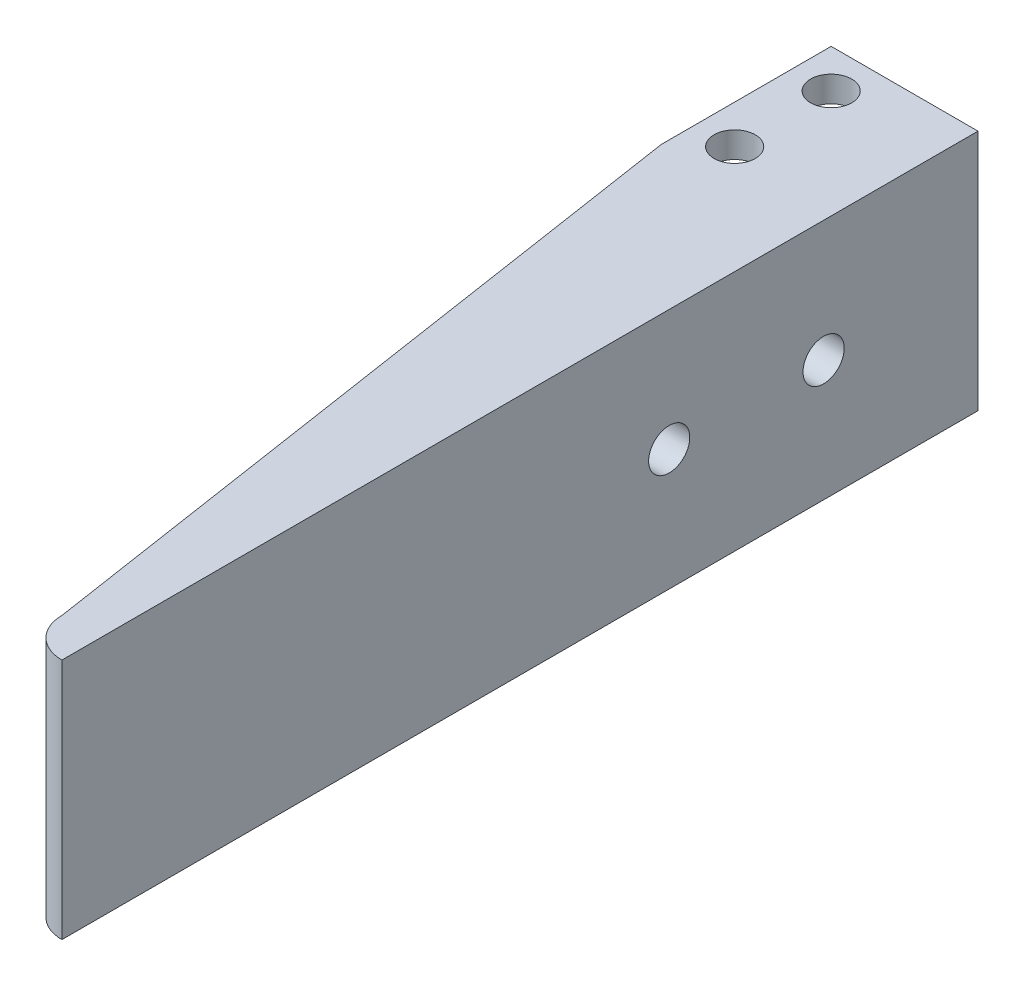
from build123d import *

# Parameters (mm, degrees)
SKETCH1_R               = 1.6
BOSS_EXTRUDE1_DEPTH     = 2
BOSS_EXTRUDE2_START     = 7.41
BOSS_EXTRUDE2_DEPTH     = 7.41
CUT_EXTRUDE1_DEPTH      = 74.641853292
CUT_EXTRUDE1_DEPTH_BACK = 74.641853292
SKETCH3_R               = 1.6


with BuildPart() as part:
    # Sketch1 → Boss-Extrude1 (new body)
    with BuildSketch(Plane(origin=(0, 0, 0), x_dir=(1, 0, 0), z_dir=(0, 1, 0))):
        with BuildLine():
            Line((-5.70625, 0), (5.70625, 0))
            Line((5.70625, 0), (5.70625, -71.2))
            ThreePointArc((5.70625, -71.2), (3.584929656, -70.321320344), (2.70625, -68.2))
            Line((2.70625, -68.2), (-5.70625, -13.2))
            Line((-5.70625, -13.2), (-5.70625, 0))
        make_face()
        with Locations(Location((-2.70625, -3, 0), (0, 0, 270))):
            Circle(SKETCH1_R, mode=Mode.SUBTRACT)
        with Locations(Location((-2.70625, -10.5, 0), (0, 0, 270))):
            Circle(SKETCH1_R, mode=Mode.SUBTRACT)
    boss_extrude1 = extrude(amount=BOSS_EXTRUDE1_DEPTH)

    # Sketch2 → Boss-Extrude2 (add)
    with BuildSketch(Plane.XZ.offset(BOSS_EXTRUDE2_START)):
        with BuildLine():
            Line((5.70625, 71.2), (5.70625, 0))
            Line((5.70625, 0), (2.70625, 0))
            Line((2.70625, 0), (2.70625, 68.2))
            ThreePointArc((2.70625, 68.2), (3.584929656, 70.321320344), (5.70625, 71.2))
        make_face()
    boss_extrude2 = extrude(amount=-BOSS_EXTRUDE2_DEPTH)

    # Mirror6: Boss-Extrude2 across plane
    add(boss_extrude2.mirror(Plane(origin=(0, -7.41, 0), x_dir=(0, 0, 1), z_dir=(0, -1, 0))))

    # Mirror7: Boss-Extrude1 across plane
    add(boss_extrude1.mirror(Plane(origin=(0, -7.41, 0), x_dir=(0, 0, 1), z_dir=(0, -1, 0))))

    # Sketch3 → Cut-Extrude1 (cut, two sides: drawn at the far end of the back side and taken through both)
    with BuildSketch(Plane.ZY.offset(-2.70625).offset(-CUT_EXTRUDE1_DEPTH_BACK)):
        with Locations((24, -7.41)):
            Circle(SKETCH3_R)
        with Locations((12, -7.41)):
            Circle(SKETCH3_R)
    extrude(amount=CUT_EXTRUDE1_DEPTH + CUT_EXTRUDE1_DEPTH_BACK, mode=Mode.SUBTRACT)


solid = part.part
